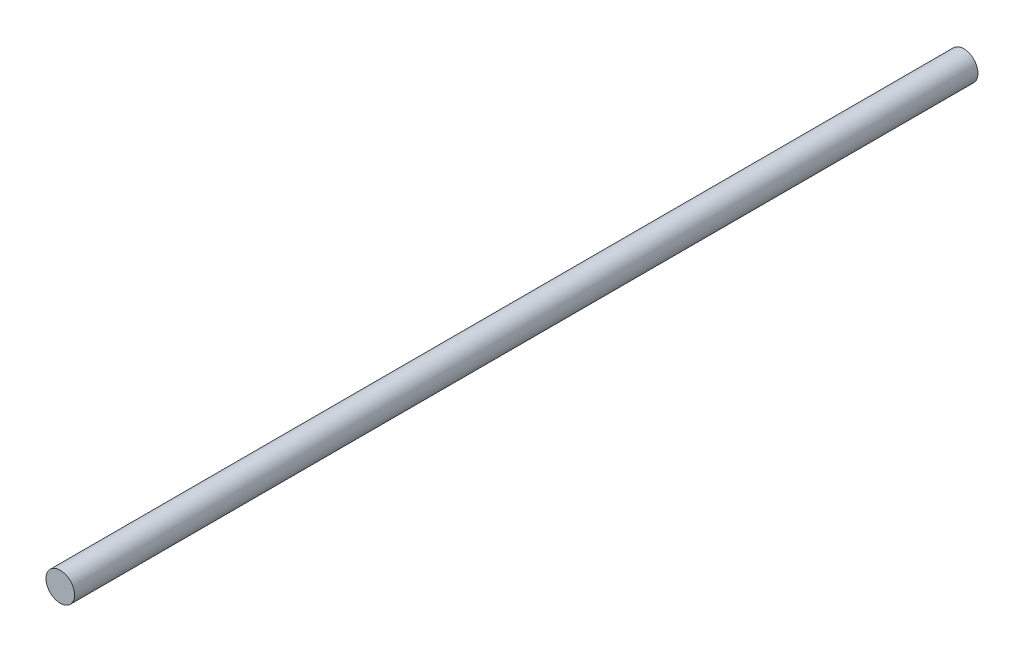
from build123d import *

# Parameters (mm, degrees)
CROQUIS1_R              = 4
SALIENTE_EXTRUIR1_DEPTH = 252.5


with BuildPart() as part:
    # Croquis1 → Saliente-Extruir1 (new body)
    with BuildSketch(Plane.XY):
        with Locations((0, 26)):
            Circle(CROQUIS1_R)
    extrude(amount=-SALIENTE_EXTRUIR1_DEPTH)


solid = part.part
